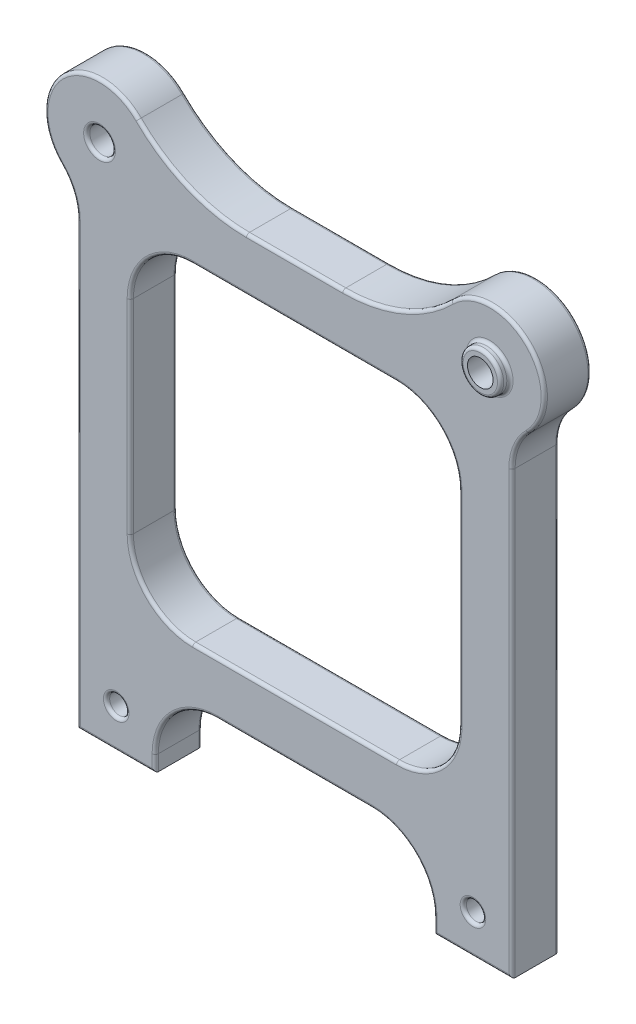
from build123d import *
from build123d.topology import SkipClean

# Parameters (mm, degrees)
SKETCH1_R           = 3.1
SKETCH1_R_2         = 4.1
SKETCH1_W           = 105.3
SKETCH1_H           = 105.3
BOSS_EXTRUDE2_DEPTH = 15
FILLET3_R           = 20
FILLET5_R           = 20
SKETCH8_R           = 6.5
SKETCH8_R_2         = 4.1
BOSS_EXTRUDE7_DEPTH = 3
BOSS_EXTRUDE8_START = 3
SKETCH9_R           = 6.5
SKETCH9_R_2         = 4.1
BOSS_EXTRUDE8_DEPTH = 3
FILLET1_R           = 1
FILLET6_R           = 1


with BuildPart() as part:
    # Sketch1 → Boss-Extrude2 (new body)
    with BuildSketch(Plane.XY):
        with BuildLine():
            Line((69.65, -94.65), (69.65, -69.65))
            Line((69.65, -69.65), (69.65, 46.662889629))
            ThreePointArc((69.65, 46.662889629), (71.00776918, 53.48885625), (74.874368671, 59.275631329))
            ThreePointArc((74.874368671, 59.275631329), (74.874368671, 84.024368671), (50.125631329, 84.024368671))
            ThreePointArc((50.125631329, 84.024368671), (34.203853282, 73.385776702), (15.422835534, 69.65))
            Line((15.422835534, 69.65), (-15.422835534, 69.65))
            ThreePointArc((-15.422835534, 69.65), (-34.203853282, 73.385776702), (-50.125631329, 84.024368671))
            ThreePointArc((-50.125631329, 84.024368671), (-74.874368671, 84.024368671), (-74.874368671, 59.275631329))
            ThreePointArc((-74.874368671, 59.275631329), (-71.00776918, 53.48885625), (-69.65, 46.662889629))
            Line((-69.65, 46.662889629), (-69.65, -69.65))
            Line((-69.65, -69.65), (-69.65, -94.65))
            Line((-69.65, -94.65), (-44.65, -94.65))
            Line((-44.65, -94.65), (-44.65, -69.65))
            Line((-44.65, -69.65), (44.65, -69.65))
            Line((44.65, -69.65), (44.65, -94.65))
            Line((44.65, -94.65), (69.65, -94.65))
        make_face()
        with Locations((-57.15, -82.15)):
            Circle(SKETCH1_R, mode=Mode.SUBTRACT)
        with Locations((57.15, -82.15)):
            Circle(SKETCH1_R, mode=Mode.SUBTRACT)
        with Locations((-62.5, 71.65)):
            Circle(SKETCH1_R_2, mode=Mode.SUBTRACT)
        Rectangle(SKETCH1_W, SKETCH1_H, mode=Mode.SUBTRACT)
        with Locations((62.5, 71.65)):
            Circle(SKETCH1_R_2, mode=Mode.SUBTRACT)
    extrude(amount=BOSS_EXTRUDE2_DEPTH)

    # Fillet3
    fillet3_edges = [part.edges().sort_by_distance(p)[0] for p in [
        (52.65, 52.65, 7.5),
        (-52.65, 52.65, 7.5),
        (-52.65, -52.65, 7.5),
        (52.65, -52.65, 7.5),
    ]]
    fillet(fillet3_edges, radius=FILLET3_R)

    # Fillet5
    fillet5_edges = [part.edges().sort_by_distance(p)[0] for p in [
        (44.65, -69.65, 7.5),
        (-44.65, -69.65, 7.5),
    ]]
    fillet(fillet5_edges, radius=FILLET5_R)

    # Sketch8 → Boss-Extrude7 (add)
    with BuildSketch(Plane.XY.offset(15)):
        with Locations((62.5, 71.65)):
            Circle(SKETCH8_R)
        with Locations((62.5, 71.65)):
            Circle(SKETCH8_R_2, mode=Mode.SUBTRACT)
    extrude(amount=BOSS_EXTRUDE7_DEPTH)

    # Sketch9 → Boss-Extrude8 (add)
    with SkipClean():  # the faces are left unmerged after this step: merging them gives an invalid solid
        with BuildSketch(Plane(origin=(0, 0, 0), x_dir=(-1, 0, 0), z_dir=(0, 0, -1)).offset(BOSS_EXTRUDE8_START)):
            with Locations(Location((62.5, 71.65, 0), (0, 0, 180))):
                Circle(SKETCH9_R)
            with Locations((62.5, 71.65)):
                Circle(SKETCH9_R_2, mode=Mode.SUBTRACT)
        extrude(amount=-BOSS_EXTRUDE8_DEPTH)

    # Fillet1
    fillet1_edges = [part.edges().sort_by_distance(p)[0] for p in [
        (0, 69.65, 15),
        (56, 71.65, 15),
        (-69, 71.65, 0),
        (-34.203853282, 73.385776702, 15),
        (-74.874368671, 84.024368671, 15),
        (-71.00776918, 53.48885625, 15),
        (54.05, -82.15, 0),
        (-60.25, -82.15, 0),
        (-69.65, -23.993555185, 15),
        (58.4, 71.65, 0),
        (34.203853282, 73.385776702, 0),
        (74.874368671, 84.024368671, 0),
        (71.00776918, 53.48885625, 0),
        (69.65, -23.993555185, 0),
        (57.15, -94.65, 0),
        (44.65, -92.15, 0),
        (-44.65, -92.15, 0),
        (-57.15, -94.65, 15),
        (-57.15, -94.65, 0),
        (-69.65, -23.993555185, 0),
        (-71.00776918, 53.48885625, 0),
        (-74.874368671, 84.024368671, 0),
        (-34.203853282, 73.385776702, 0),
        (0, 69.65, 0),
        (-44.65, -92.15, 15),
        (44.65, -92.15, 15),
        (57.15, -94.65, 15),
        (69.65, -23.993555185, 15),
        (71.00776918, 53.48885625, 15),
        (74.874368671, 84.024368671, 15),
        (34.203853282, 73.385776702, 15),
        (52.65, 0, 0),
        (52.65, 0, 15),
        (0, 52.65, 0),
        (0, 52.65, 15),
        (0, -52.65, 0),
        (0, -52.65, 15),
        (-66.6, 71.65, 15),
        (-52.65, 0, 0),
        (-52.65, 0, 15),
        (46.792135624, 46.792135624, 0),
        (46.792135624, 46.792135624, 15),
        (46.792135624, -46.792135624, 0),
        (46.792135624, -46.792135624, 15),
        (-46.792135624, -46.792135624, 0),
        (-46.792135624, -46.792135624, 15),
        (-46.792135624, 46.792135624, 0),
        (-46.792135624, 46.792135624, 15),
        (0, -69.65, 0),
        (0, -69.65, 15),
        (-60.25, -82.15, 15),
        (-38.792135624, -75.507864376, 0),
        (-38.792135624, -75.507864376, 15),
        (38.792135624, -75.507864376, 0),
        (38.792135624, -75.507864376, 15),
        (54.05, -82.15, 15),
    ]]
    fillet(fillet1_edges, radius=FILLET1_R)

    # Fillet6
    fillet6_edges = [part.edges().sort_by_distance(p)[0] for p in [
        (56, 71.65, 18),
        (-69, 71.65, -3),
    ]]
    fillet(fillet6_edges, radius=FILLET6_R)


solid = part.part
